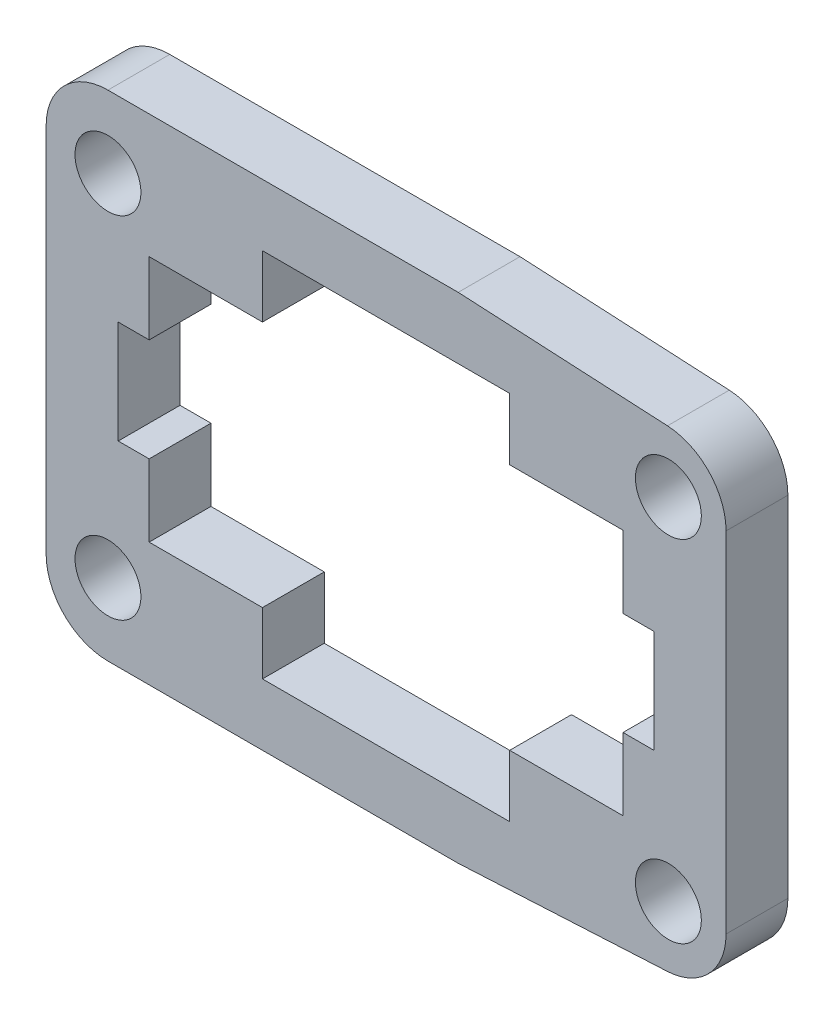
from build123d import *

# Parameters (mm, degrees)
SKETCH_1_R          = 1.35
EXTRUDE_1_DEPTH     = 3
SKETCH_2_R          = 1.6
CUT_EXTRUDE_1_DEPTH = 37.133094234


with BuildPart() as part:
    # 草图1 → 凸台-拉伸1 (new body)
    with BuildSketch(Plane.XY.offset(3)):
        with BuildLine():
            Line((13.843681844, 23.9998), (-3.157118156, 23.9998))
            ThreePointArc((-3.157118156, 23.9998), (-5.2784385, 23.121120344), (-6.157118156, 20.9998))
            Line((-6.157118156, 20.9998), (-6.157118156, 3))
            ThreePointArc((-6.157118156, 3), (-5.2784385, 0.878679656), (-3.157118156, 0))
            Line((-3.157118156, 0), (13.843681844, 0))
            Line((13.843681844, 0), (24.001386189, 0.533010723))
            ThreePointArc((24.001386189, 0.533010723), (26.020372671, 1.463896655), (26.844181844, 3.528889024))
            Line((26.844181844, 3.528889024), (26.844181844, 20.471910982))
            ThreePointArc((26.844181844, 20.471910982), (26.020271299, 22.537010177), (24.001092054, 23.467804703))
            Line((24.001092054, 23.467804703), (13.843681844, 23.9998))
        make_face()
        with Locations(Location((24.044031844, 3.501148349, 0), (0, 0, 180))):
            Circle(SKETCH_1_R, mode=Mode.SUBTRACT)
        with Locations(Location((-3.156018156, 3.501148349, 0), (0, 0, 180))):
            Circle(SKETCH_1_R, mode=Mode.SUBTRACT)
        with Locations(Location((24.044031844, 20.498351651, 0), (0, 0, 180))):
            Circle(SKETCH_1_R, mode=Mode.SUBTRACT)
        with Locations(Location((-3.156018156, 20.498351651, 0), (0, 0, 180))):
            Circle(SKETCH_1_R, mode=Mode.SUBTRACT)
        Polygon((21.843181844, 14.4995), (23.343481844, 14.4995), (23.343481844, 9.5), (21.843181844, 9.5), (21.843181844, 6), (16.343381844, 6), (16.343381844, 3), (4.343381844, 3), (4.343381844, 6), (-1.156518156, 6), (-1.156518156, 9.5), (-2.656818156, 9.5), (-2.656818156, 14.4995), (-1.156518156, 14.4995), (-1.156518156, 17.9998), (4.343381844, 17.9998), (4.343381844, 20.9998), (16.343381844, 20.9998), (16.343381844, 17.9998), (21.843181844, 17.9998), align=None, mode=Mode.SUBTRACT)
    extrude(amount=-EXTRUDE_1_DEPTH)

    # 草图2 → 切除-拉伸1 (cut, through all)
    with BuildSketch(Plane.XY.offset(3)):
        with Locations((-3.156018156, 20.498351651)):
            Circle(SKETCH_2_R)
        with Locations((24.044031844, 20.498351651)):
            Circle(SKETCH_2_R)
        with Locations((24.044031844, 3.501148349)):
            Circle(SKETCH_2_R)
        with Locations((-3.156018156, 3.501148349)):
            Circle(SKETCH_2_R)
    extrude(amount=-CUT_EXTRUDE_1_DEPTH, mode=Mode.SUBTRACT)


solid = part.part
